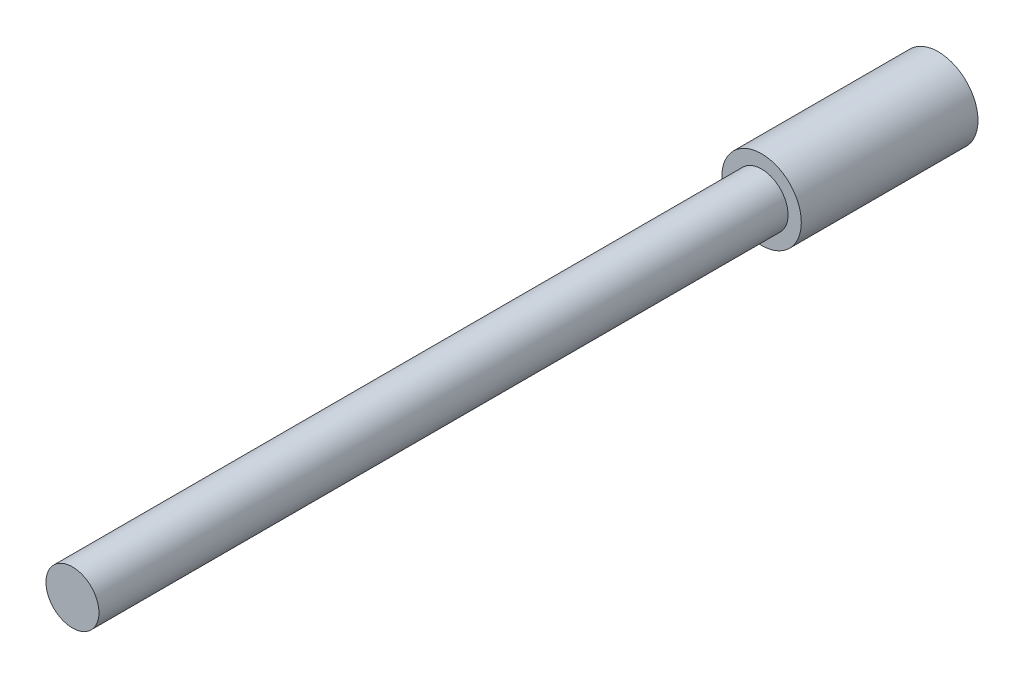
from build123d import *

# Parameters (mm, degrees)
SKETCH1_R           = 2.25
BOSS_EXTRUDE1_DEPTH = 10
SKETCH2_R           = 1.5
BOSS_EXTRUDE2_DEPTH = 39
SKETCH3_R           = 1.5
CUT_EXTRUDE1_DEPTH  = 4.5


with BuildPart() as part:
    # Sketch1 → Boss-Extrude1 (new body)
    with BuildSketch(Plane.XY):
        Circle(SKETCH1_R)
    extrude(amount=BOSS_EXTRUDE1_DEPTH)

    # Sketch2 → Boss-Extrude2 (add)
    with BuildSketch(Plane.XY.offset(10)):
        Circle(SKETCH2_R)
    extrude(amount=BOSS_EXTRUDE2_DEPTH)

    # Sketch3 → Cut-Extrude1 (cut)
    with BuildSketch(Plane(origin=(0, 0, 0), x_dir=(-1, 0, 0), z_dir=(0, 0, -1))):
        with Locations(Location((0, 0, 0), (0, 0, 180))):
            Circle(SKETCH3_R)
    extrude(amount=-CUT_EXTRUDE1_DEPTH, mode=Mode.SUBTRACT)


solid = part.part
